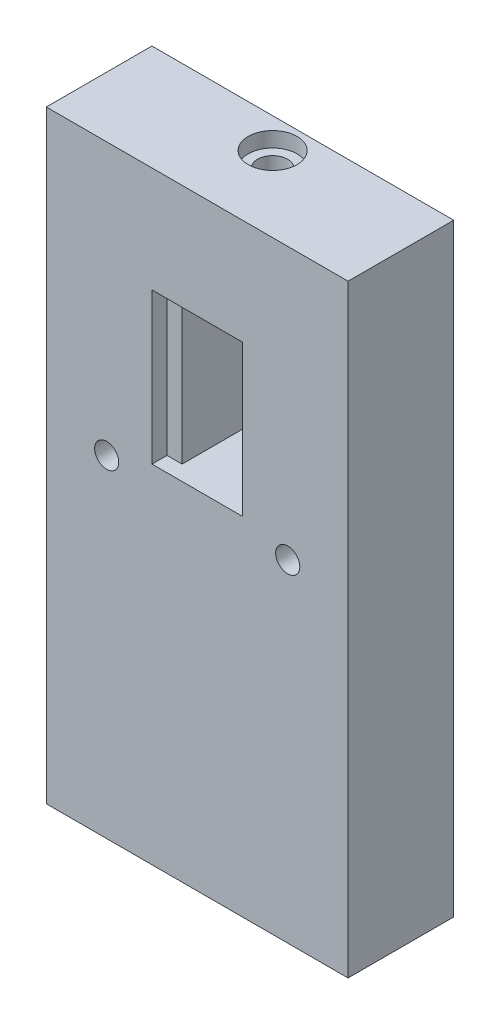
from build123d import *

# Parameters (mm, degrees)
SKETCH1_W           = 100
SKETCH1_H           = 200
BOSS_EXTRUDE1_DEPTH = 35
SKETCH2_R           = 4
CUT_EXTRUDE1_DEPTH  = 30
SKETCH3_R           = 5
CUT_EXTRUDE2_DEPTH  = 210.105236663
SKETCH4_W           = 20
SKETCH4_H           = 50
CUT_EXTRUDE3_DEPTH  = 118.153745139
SKETCH6_R           = 8.1
CUT_EXTRUDE4_DEPTH  = 5
SKETCH7_W           = 30
SKETCH7_H           = 50
CUT_EXTRUDE5_DEPTH  = 5


with BuildPart() as part:
    # Sketch1 → Boss-Extrude1 (new body)
    with BuildSketch(Plane.XY):
        Rectangle(SKETCH1_W, SKETCH1_H)
    extrude(amount=BOSS_EXTRUDE1_DEPTH)

    # Sketch2 → Cut-Extrude1 (cut)
    with BuildSketch(Plane.XY.offset(35)):
        with Locations((-30, 10)):
            Circle(SKETCH2_R)
        with Locations((30, 10)):
            Circle(SKETCH2_R)
    extrude(amount=-CUT_EXTRUDE1_DEPTH, mode=Mode.SUBTRACT)

    # Sketch3 → Cut-Extrude2 (cut, through all)
    with BuildSketch(Plane(origin=(0, 100, 0), x_dir=(1, 0, 0), z_dir=(0, 1, 0))):
        with Locations(Location((0, -10, 0), (0, 0, 270))):
            Circle(SKETCH3_R)
    extrude(amount=-CUT_EXTRUDE2_DEPTH, mode=Mode.SUBTRACT)

    # Sketch4 → Cut-Extrude3 (cut, through all)
    with BuildSketch(Plane(origin=(0, 0, 0), x_dir=(-1, 0, 0), z_dir=(0, 0, -1))):
        with Locations((0, 40)):
            Rectangle(SKETCH4_W, SKETCH4_H)
    extrude(amount=-CUT_EXTRUDE3_DEPTH, mode=Mode.SUBTRACT)

    # Sketch6 → Cut-Extrude4 (cut)
    with BuildSketch(Plane(origin=(0, 100, 0), x_dir=(1, 0, 0), z_dir=(0, 1, 0))):
        with Locations(Location((0, -10, 0), (0, 0, 270))):
            Circle(SKETCH6_R)
    cut_extrude4 = extrude(amount=-CUT_EXTRUDE4_DEPTH, mode=Mode.SUBTRACT)

    # Mirror1: Cut-Extrude4 across plane
    add(cut_extrude4.mirror(Plane.ZX), mode=Mode.SUBTRACT)

    # Sketch7 → Cut-Extrude5 (cut)
    with BuildSketch(Plane.XY.offset(35)):
        with Locations((0, 40)):
            Rectangle(SKETCH7_W, SKETCH7_H)
    extrude(amount=-CUT_EXTRUDE5_DEPTH, mode=Mode.SUBTRACT)


solid = part.part
